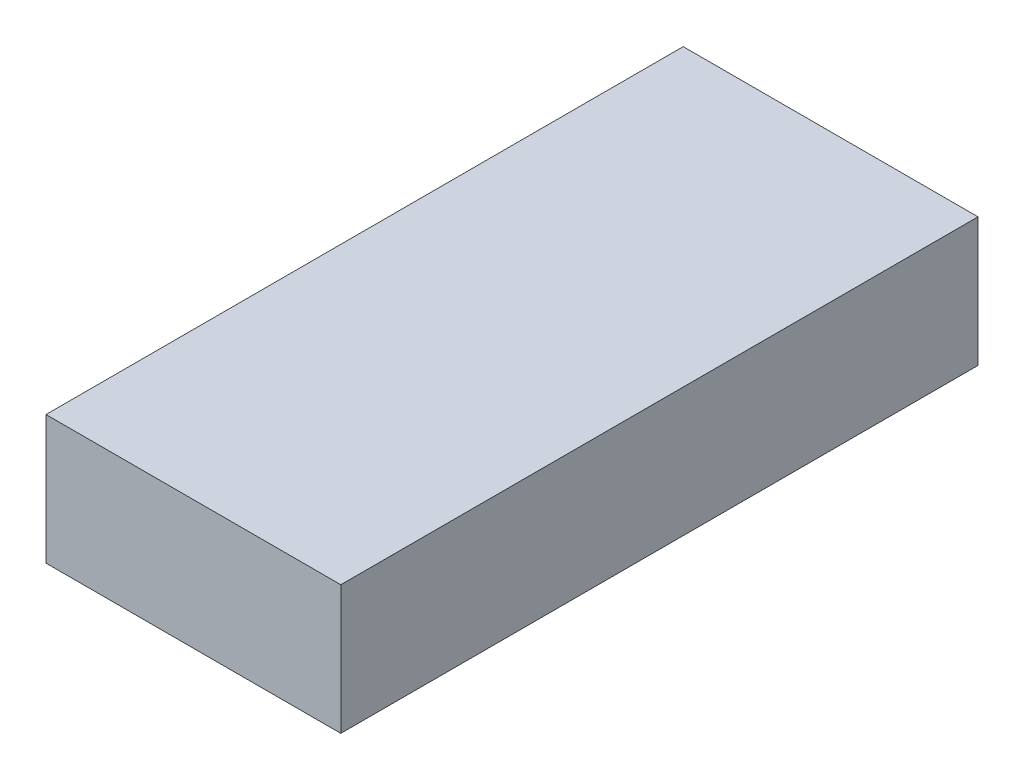
from build123d import *

# Parameters (mm, degrees)
SKETCH1_W           = 22.9
SKETCH1_H           = 49.5
BOSS_EXTRUDE1_DEPTH = 10


with BuildPart() as part:
    # Sketch1 → Boss-Extrude1 (new body)
    with BuildSketch(Plane(origin=(0, 0, 0), x_dir=(1, 0, 0), z_dir=(0, 1, 0))):
        with Locations((-53.606444224, 9.198976924)):
            Rectangle(SKETCH1_W, SKETCH1_H)
    extrude(amount=BOSS_EXTRUDE1_DEPTH)


solid = part.part
